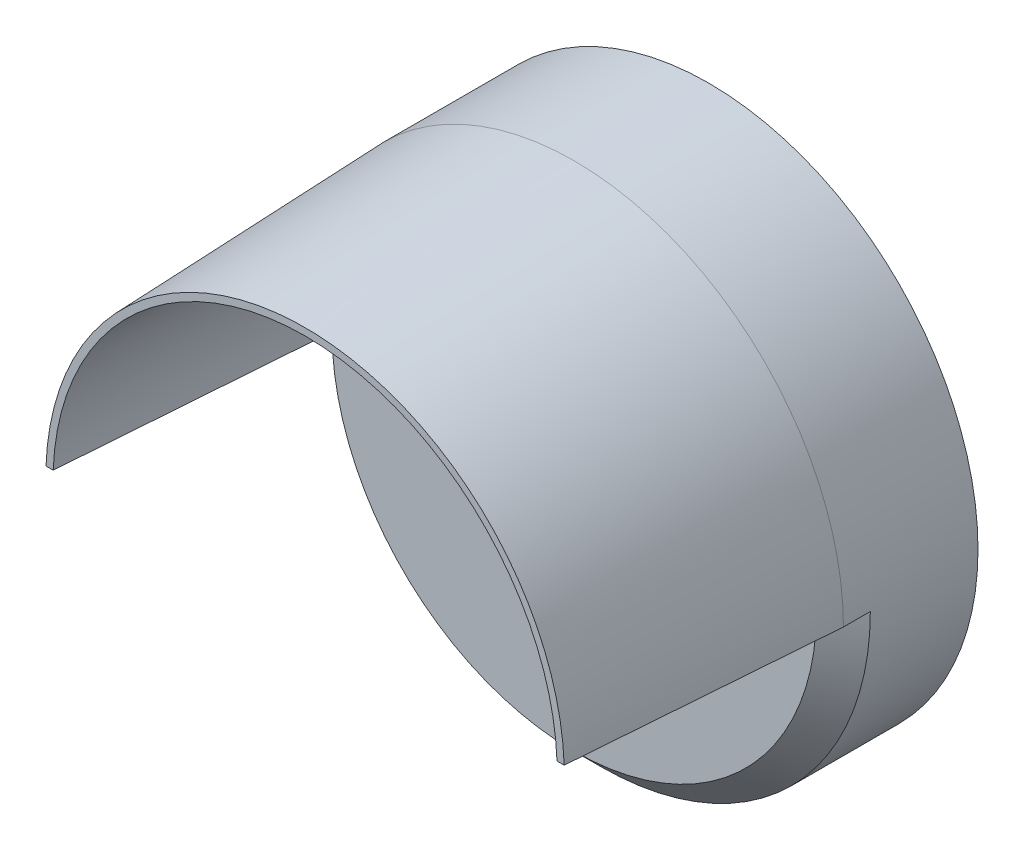
from build123d import *

# Parameters (mm, degrees)
SKETCH1_R                     = 25.4
SKETCH1_R_2                   = 9.525
BOSS_EXTRUDE1_DEPTH           = 12.7
CHAMFER1_SIZE                 = 2.54
FILLET1_R                     = 1.27
EXTRUDE_THIN2_DEPTH           = 25.4
EXTRUDE_THIN2_DRAFT           = 2.1
EXTRUDE_THIN2_OTHER_WAY_DEPTH = 2.54


with BuildPart() as part:
    # Sketch1 → Boss-Extrude1 (new body)
    with BuildSketch(Plane.XY):
        Circle(SKETCH1_R)
        Circle(SKETCH1_R_2, mode=Mode.SUBTRACT)
    extrude(amount=BOSS_EXTRUDE1_DEPTH)

    # Chamfer1
    chamfer1_edges = [part.edges().sort_by_distance(p)[0] for p in [
        (-25.4, 0, 12.7),
    ]]
    chamfer(chamfer1_edges, length=CHAMFER1_SIZE)

    # Fillet1
    fillet1_edges = [part.edges().sort_by_distance(p)[0] for p in [
        (-9.525, 0, 12.7),
    ]]
    fillet(fillet1_edges, radius=FILLET1_R)


with BuildPart() as extrude_thin2_tool:
    # Sketch2 → Extrude-Thin2 (with draft: the straight prism first)
    with BuildSketch(Plane.XY.offset(12.7)):
        with BuildLine():
            Line((22.86, 0), (25.4, 0))
            ThreePointArc((25.4, 0), (0, 25.4), (-25.4, 0))
            Line((-25.4, 0), (-22.86, 0))
            ThreePointArc((-22.86, 0), (0, 22.86), (22.86, 0))
        make_face()
    extrude(amount=EXTRUDE_THIN2_DEPTH)
    # Extrude-Thin2: the draft: its side faces are tilted about the plane it starts from
    extrude_thin2_sides = [extrude_thin2_tool.faces().sort_by_distance(p)[0] for p in [
        (24.13, 0, 25.4),
        (0, 25.4, 25.4),
        (-24.13, 0, 25.4),
        (0, 22.86, 25.4),
    ]]
    draft(extrude_thin2_sides, Plane.XY.offset(12.7), EXTRUDE_THIN2_DRAFT)


with BuildPart() as part_1:
    add(part.part)

    # Extrude-Thin2: add extrude_thin2_tool
    add(extrude_thin2_tool.part)

    # Sketch2 → Extrude-Thin2 other way (add)
    with BuildSketch(Plane.XY.offset(12.7)):
        with BuildLine():
            Line((22.86, 0), (25.4, 0))
            ThreePointArc((25.4, 0), (0, 25.4), (-25.4, 0))
            Line((-25.4, 0), (-22.86, 0))
            ThreePointArc((-22.86, 0), (0, 22.86), (22.86, 0))
        make_face()
    extrude(amount=-EXTRUDE_THIN2_OTHER_WAY_DEPTH)


solid = part_1.part
